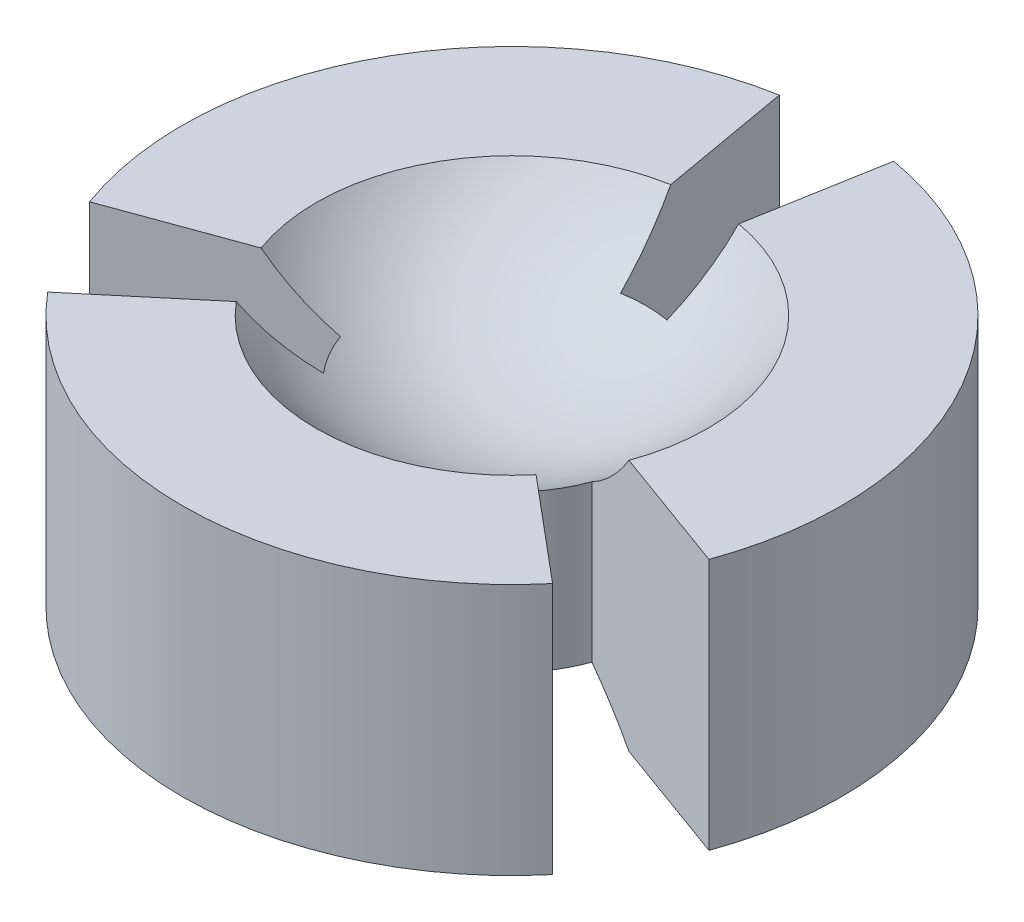
from build123d import *

# Parameters (mm, degrees)
CUT_EXTRUDE_1_DEPTH = 8.918334965


with BuildPart() as part:
    # 草图1 → 旋转2 (revolve)
    with BuildSketch(Plane.XY):
        with BuildLine():
            Line((-2.925029572, 5.6), (-4.925029572, 5.6))
            Line((-4.925029572, 5.6), (-4.925029572, 9.366722189))
            Line((-4.925029572, 9.366722189), (-2.925029572, 9.366722189))
            ThreePointArc((-2.925029572, 9.366722189), (-1.636083126, 8.287220203), (0, 7.9))
            Line((0, 7.9), (0, 6.6))
            ThreePointArc((0, 6.6), (-1.54562269, 6.343093076), (-2.925029572, 5.6))
        make_face()
    revolve(axis=Axis((0, 7.9, 0), (0, -1, 0)))

    # 草图2 → 切除-拉伸1 (cut, through all)
    with BuildSketch(Plane(origin=(0, 9.366722189, 0), x_dir=(1, 0, 0), z_dir=(0, 1, 0))):
        with BuildLine():
            Line((-0.347296355, 1.969615506), (-1.736481777, 9.84807753))
            ThreePointArc((-1.736481777, 9.84807753), (0, 10), (1.736481777, 9.84807753))
            Line((1.736481777, 9.84807753), (0.347296355, 1.969615506))
            ThreePointArc((0.347296355, 1.969615506), (0, 2), (-0.347296355, 1.969615506))
        make_face()
        with BuildLine():
            Line((1.879385242, -0.684040287), (9.396926208, -3.420201433))
            ThreePointArc((9.396926208, -3.420201433), (8.660254038, -5), (7.660444431, -6.427876097))
            Line((7.660444431, -6.427876097), (1.532088886, -1.285575219))
            ThreePointArc((1.532088886, -1.285575219), (1.732050808, -1), (1.879385242, -0.684040287))
        make_face()
        with BuildLine():
            Line((-1.532088886, -1.285575219), (-7.660444431, -6.427876097))
            ThreePointArc((-7.660444431, -6.427876097), (-8.660254038, -5), (-9.396926208, -3.420201433))
            Line((-9.396926208, -3.420201433), (-1.879385242, -0.684040287))
            ThreePointArc((-1.879385242, -0.684040287), (-1.732050808, -1), (-1.532088886, -1.285575219))
        make_face()
    extrude(amount=-CUT_EXTRUDE_1_DEPTH, mode=Mode.SUBTRACT)


solid = part.part
